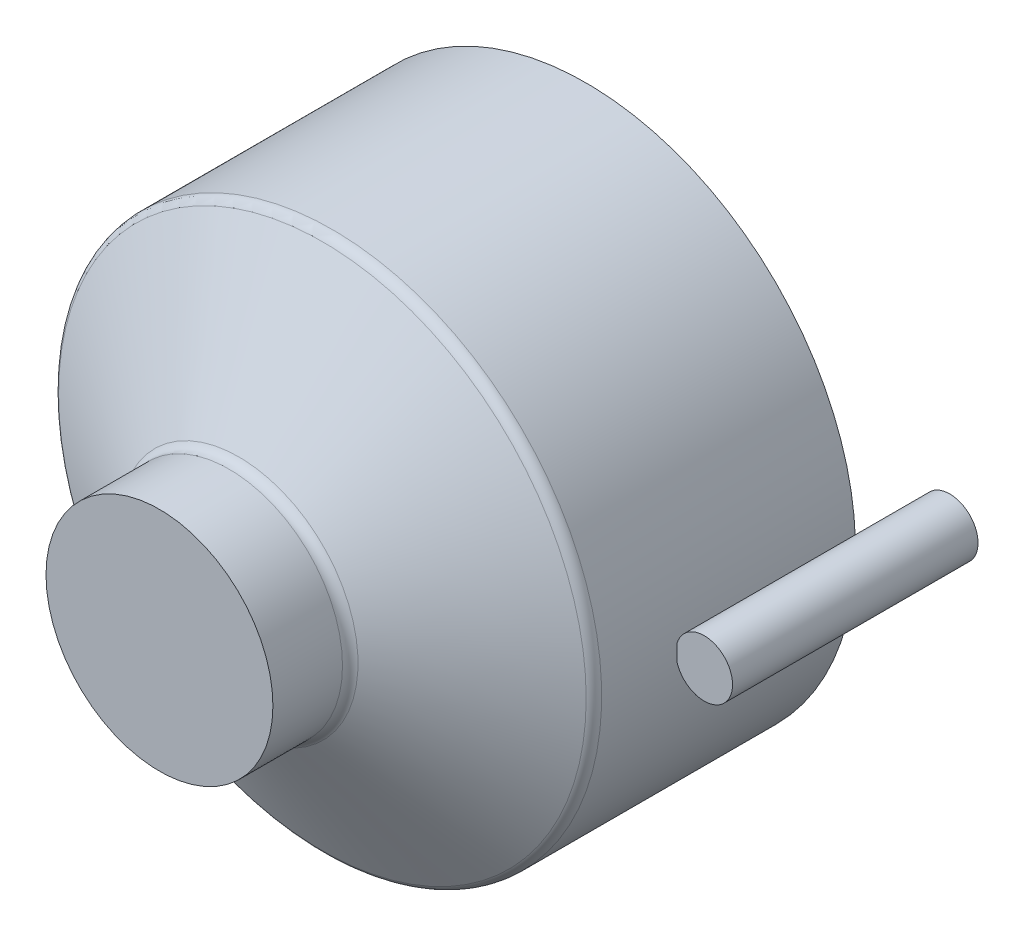
from build123d import *

# Parameters (mm, degrees)
SKETCH3_W = 25
SKETCH3_H = 216.387840678


with BuildPart() as part:
    # Sketch2 → Revolve1 (revolve)
    with BuildSketch(Plane(origin=(0, 0, 0), x_dir=(1, 0, 0), z_dir=(0, 1, 0))):
        with BuildLine():
            Line((-232.5, -44.387840678), (-105, -118))
            ThreePointArc((-105, -118), (-101.339745962, -121.660254038), (-100, -126.660254038))
            Line((-100, -126.660254038), (-100, -188))
            Line((-100, -188), (0, -188))
            Line((0, -188), (0, 188))
            Line((0, 188), (-237.5, 188))
            Line((-237.5, 188), (-237.5, -35.72758664))
            ThreePointArc((-237.5, -35.72758664), (-236.160254038, -40.72758664), (-232.5, -44.387840678))
        make_face()
    revolve(axis=Axis((0, 0, -581.773938456), (0, 0, 1)))


with BuildPart() as body_2:
    # Sketch3 → Revolve2 (revolve)
    with BuildSketch(Plane(origin=(0, 0, 0), x_dir=(1, 0, 0), z_dir=(0, 1, 0))):
        with Locations((249, 138.806079661)):
            Rectangle(SKETCH3_W, SKETCH3_H)
    revolve(axis=Axis((261.5, 0, -182.650020504), (0, 0, 1)))

    # Combine3: union part
    add(part.part)


solid = body_2.part
